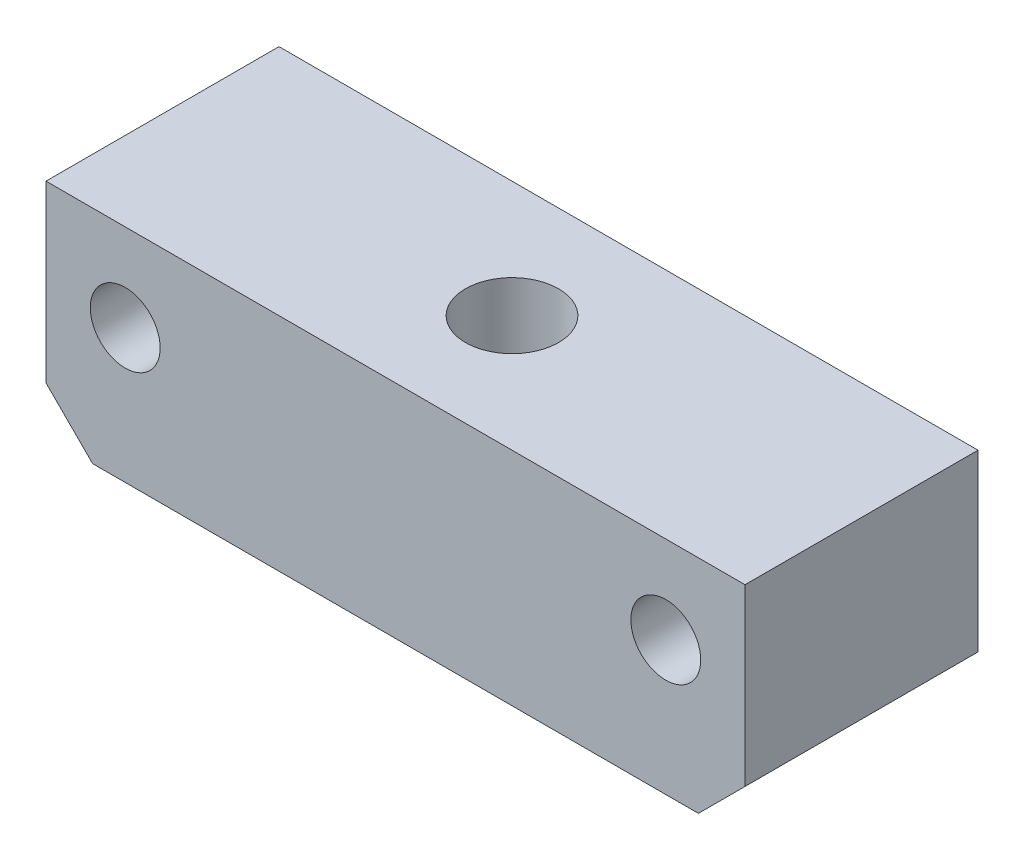
from build123d import *

# Parameters (mm, degrees)
SKETCH1_R                     = 1.5
BOSS_EXTRUDE1_DEPTH           = 10
CSK_FOR_M4_SFHCS1_D           = 4
CSK_FOR_M4_SFHCS1_DEPTH       = 19
CSK_FOR_M4_SFHCS1_CSINK_D     = 7.9
CSK_FOR_M4_SFHCS1_CSINK_ANGLE = 90
CSK_FOR_M4_SFHCS1_TIP         = 1.201721238


with BuildPart() as part:
    # Sketch1 → Boss-Extrude1 (new body)
    with BuildSketch(Plane.XY):
        Polygon((-15, 2.5), (-15, -5), (-13, -7), (13, -7), (15, -5), (15, 2.5), align=None)
        with Locations((11.6, -1.25)):
            Circle(SKETCH1_R, mode=Mode.SUBTRACT)
        with Locations((-11.6, -1.25)):
            Circle(SKETCH1_R, mode=Mode.SUBTRACT)
    extrude(amount=BOSS_EXTRUDE1_DEPTH)

    # CSK for M4 SFHCS1
    with Locations(Plane(origin=(1278.247292614, -7, -931.083024415), x_dir=(1, 0, 0), z_dir=(0, -1, 0))):
        with Locations((-1278.247292614, 936.083024415)):
            CounterSinkHole(CSK_FOR_M4_SFHCS1_D / 2, CSK_FOR_M4_SFHCS1_CSINK_D / 2, depth=CSK_FOR_M4_SFHCS1_DEPTH, counter_sink_angle=CSK_FOR_M4_SFHCS1_CSINK_ANGLE)
            with Locations((0, 0, -(CSK_FOR_M4_SFHCS1_DEPTH + CSK_FOR_M4_SFHCS1_TIP / 2))):  # 118° drill point
                Cone(0, CSK_FOR_M4_SFHCS1_D / 2, CSK_FOR_M4_SFHCS1_TIP, mode=Mode.SUBTRACT)


solid = part.part
